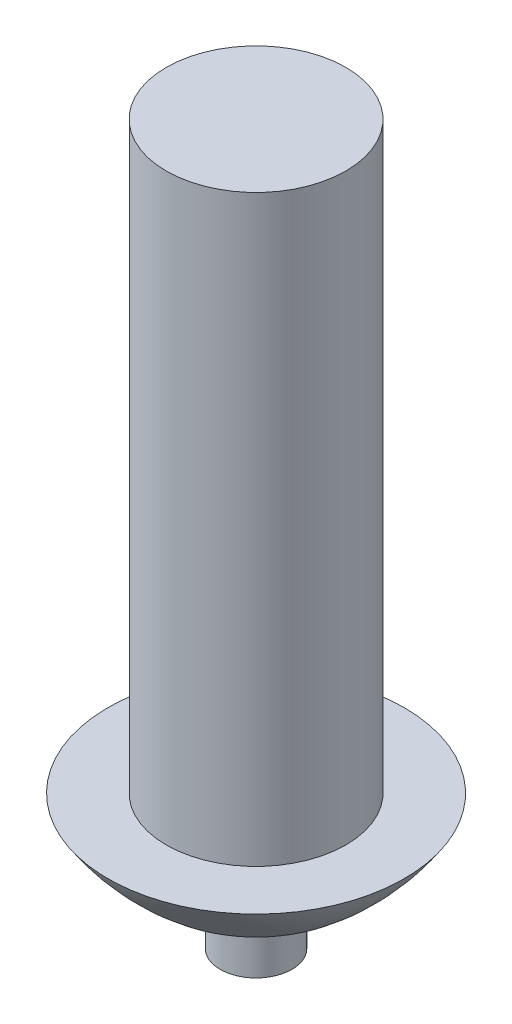
from build123d import *


with BuildPart() as part:
    # Sketch1 → Revolve1 (revolve)
    with BuildSketch(Plane(origin=(0, 0, 0), x_dir=(0, 0, -1), z_dir=(1, 0, 0))):
        with BuildLine():
            Line((0, 6.5), (0, -1.5))
            Line((0, -1.5), (0.4, -1.5))
            Line((0.4, -1.5), (0.4, -1))
            ThreePointArc((0.4, -1), (1.107202425, -0.602753031), (1.65, 0))
            Line((1.65, 0), (1, 0))
            Line((1, 0), (1, 6.5))
            Line((1, 6.5), (0, 6.5))
        make_face()
    revolve(axis=Axis((0, 0, 0), (0, 1, 0)))


solid = part.part
